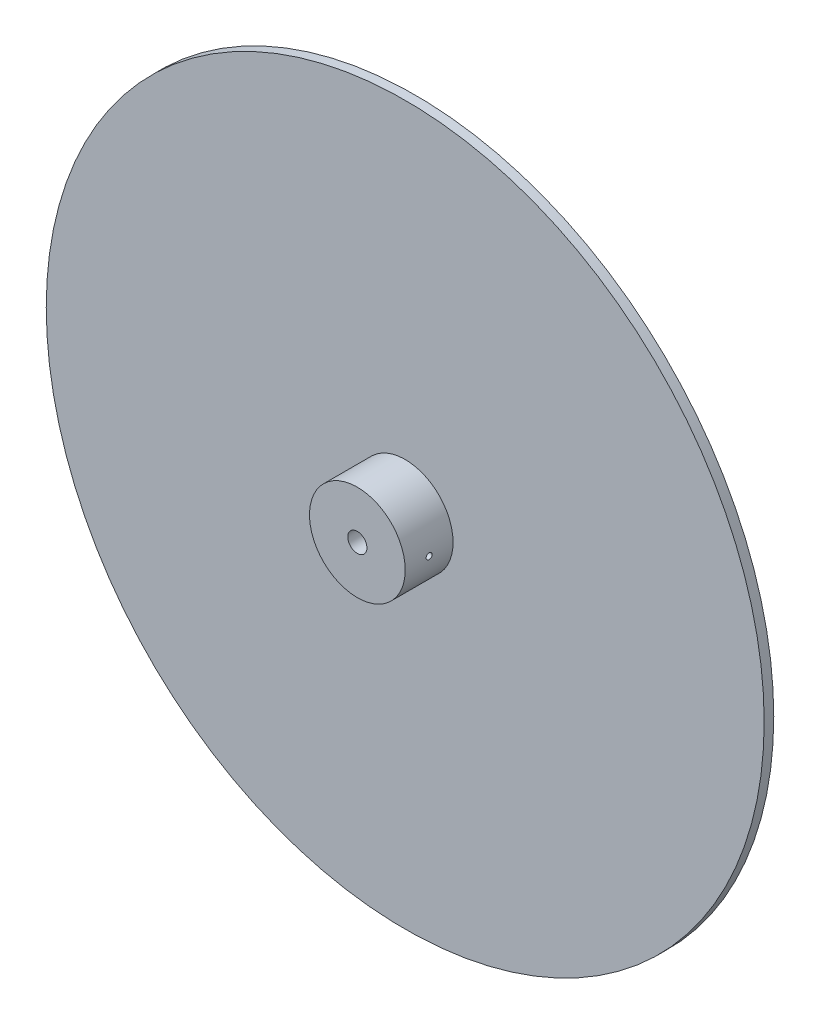
from build123d import *

# Parameters (mm, degrees)
SKETCH1_R         = 150
DISC_DEPTH        = 4
SKETCH2_R         = 20
HUB_DEPTH         = 20
SKETCH3_R         = 4
BORE_DEPTH        = 24
SKETCH4_W         = 71.782300335
SKETCH4_H         = 3
BLADE_SLOTS_DEPTH = 3
SKETCH5_R         = 1.25
CLAMP_SCREW_DEPTH = 17


with BuildPart() as part:
    # Sketch1 → Disc (new body)
    with BuildSketch(Plane.XY):
        Circle(SKETCH1_R)
    extrude(amount=DISC_DEPTH)

    # Sketch2 → Hub (add)
    with BuildSketch(Plane.XY.offset(4)):
        Circle(SKETCH2_R)
    extrude(amount=HUB_DEPTH)

    # Sketch3 → Bore (cut)
    with BuildSketch(Plane.XY):
        Circle(SKETCH3_R)
    extrude(amount=BORE_DEPTH, mode=Mode.SUBTRACT)

    # Sketch4 → Blade_slots (cut)
    with BuildSketch(Plane.XY):
        with Locations((63.2155163, -96.418141453)):
            Rectangle(SKETCH4_W, SKETCH4_H)
        Polygon((83.872246927, -57.445884148), (138.860679213, -11.305110898), (136.932316384, -9.006977568), (81.943884098, -55.147750818), align=None)
        Polygon((101.175371248, 9.90594079), (113.64023689, 80.597706689), (110.685813631, 81.118651222), (98.220947989, 10.426885323), align=None)
        Polygon((71.137414923, 72.62266594), (35.246264756, 134.787961572), (32.648188544, 133.287961572), (68.539338712, 71.12266594), align=None)
        Polygon((7.813471551, 101.358438585), (-59.639826377, 125.909431234), (-60.665886807, 123.090353372), (6.787411121, 98.539360723), align=None)
        Polygon((-59.166481997, 82.667471343), (-126.619779924, 58.116478695), (-125.593719494, 55.297400832), (-58.140421567, 79.848393481), align=None)
        Polygon((-98.461781056, 25.295475513), (-134.352931224, -36.869820119), (-131.754855012, -38.369820119), (-95.863704845, 23.795475513), align=None)
        Polygon((-91.685718479, -43.912554438), (-79.220852837, -114.604320337), (-76.266429578, -114.083375804), (-88.73129522, -43.391609905), align=None)
        Polygon((-42.008889252, -92.573412133), (12.979543034, -138.714185383), (14.907905863, -136.416052054), (-40.080526423, -90.275278804), align=None)
    extrude(amount=BLADE_SLOTS_DEPTH, mode=Mode.SUBTRACT)

    # Sketch5 → Clamp_screw (cut)
    with BuildSketch(Plane(origin=(3.5, 0, 0), x_dir=(0, 0, -1), z_dir=(1, 0, 0))):
        with Locations(Location((-14, 0, 0), (0, 0, 180))):
            Circle(SKETCH5_R)
    extrude(amount=CLAMP_SCREW_DEPTH, mode=Mode.SUBTRACT)


solid = part.part
